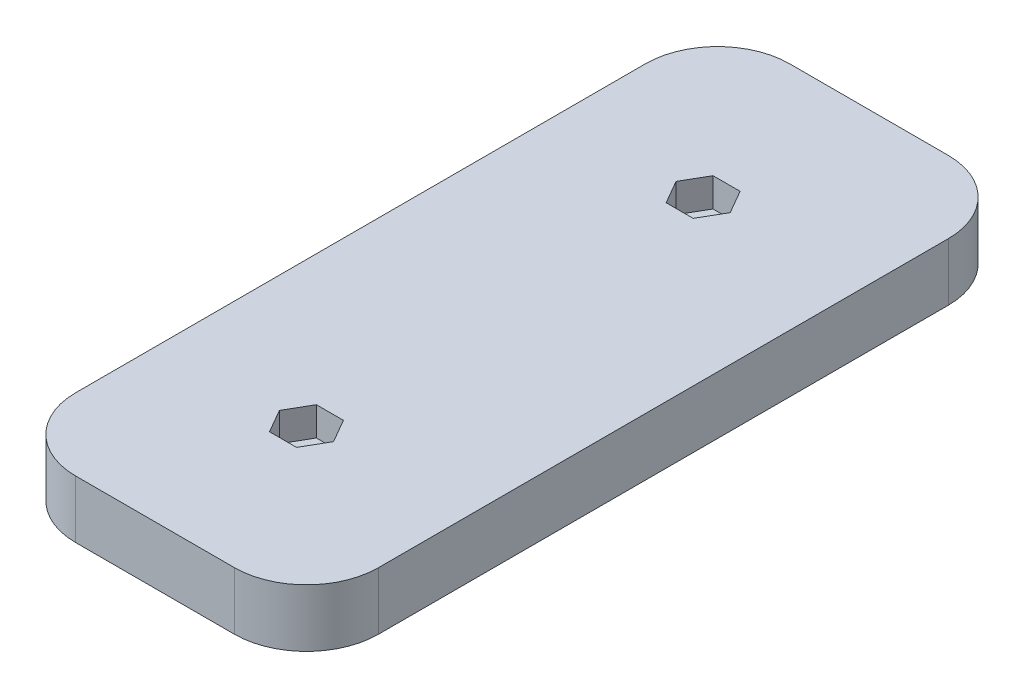
from build123d import *

# Parameters (mm, degrees)
SKETCH1_W           = 42
SKETCH1_H           = 99
SKETCH1_R           = 2
BOSS_EXTRUDE1_DEPTH = 8
CUT_EXTRUDE1_DEPTH  = 4
FILLET1_R           = 10


with BuildPart() as part:
    # Sketch1 → Boss-Extrude1 (new body)
    with BuildSketch(Plane(origin=(0, 0, 0), x_dir=(1, 0, 0), z_dir=(0, 1, 0))):
        with Locations((21, 49.5)):
            Rectangle(SKETCH1_W, SKETCH1_H)
        with Locations(Location((20, 77, 0), (0, 0, 270))):
            Circle(SKETCH1_R, mode=Mode.SUBTRACT)
        with Locations(Location((20, 22, 0), (0, 0, 270))):
            Circle(SKETCH1_R, mode=Mode.SUBTRACT)
    extrude(amount=BOSS_EXTRUDE1_DEPTH)

    # Sketch2 → Cut-Extrude1 (cut)
    with BuildSketch(Plane(origin=(0, 8, 0), x_dir=(1, 0, 0), z_dir=(0, 1, 0))):
        Polygon((21.876388375, 80.25), (18.123611625, 80.25), (16.24722325, 77), (18.123611625, 73.75), (21.876388375, 73.75), (23.75277675, 77), align=None)
        Polygon((21.876388375, 18.75), (23.75277675, 22), (21.876388375, 25.25), (18.123611625, 25.25), (16.24722325, 22), (18.123611625, 18.75), align=None)
    extrude(amount=-CUT_EXTRUDE1_DEPTH, mode=Mode.SUBTRACT)

    # Fillet1
    fillet1_edges = [part.edges().sort_by_distance(p)[0] for p in [
        (0, 4, 0),
        (0, 4, -99),
        (42, 4, -99),
        (42, 4, 0),
    ]]
    fillet(fillet1_edges, radius=FILLET1_R)


solid = part.part
